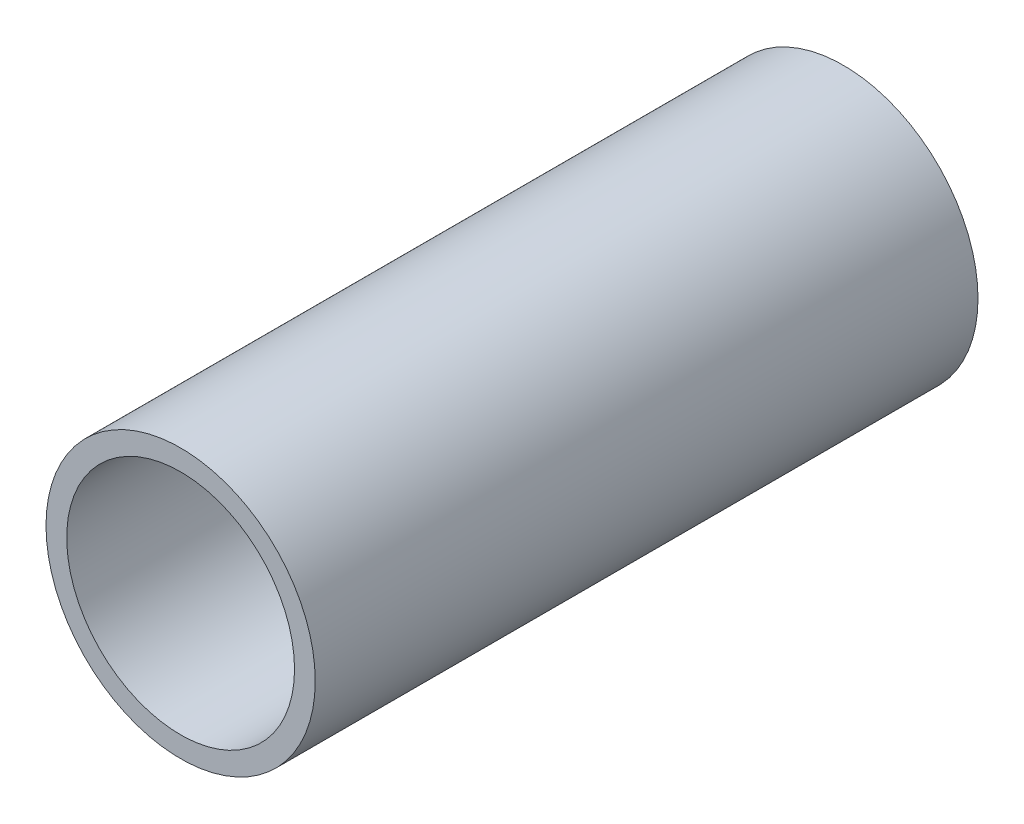
from build123d import *

# Parameters (mm, degrees)
SKETCH2_R           = 32.5
BOSS_EXTRUDE1_DEPTH = 80
SKETCH3_R           = 27.5
CUT_EXTRUDE1_DEPTH  = 167.470718146


with BuildPart() as part:
    # Sketch2 → Boss-Extrude1 (new, symmetric)
    with BuildSketch(Plane.XY):
        Circle(SKETCH2_R)
    extrude(amount=BOSS_EXTRUDE1_DEPTH, both=True)

    # Sketch3 → Cut-Extrude1 (cut, through all)
    with BuildSketch(Plane.XY.offset(80)):
        Circle(SKETCH3_R)
    extrude(amount=-CUT_EXTRUDE1_DEPTH, mode=Mode.SUBTRACT)


solid = part.part
